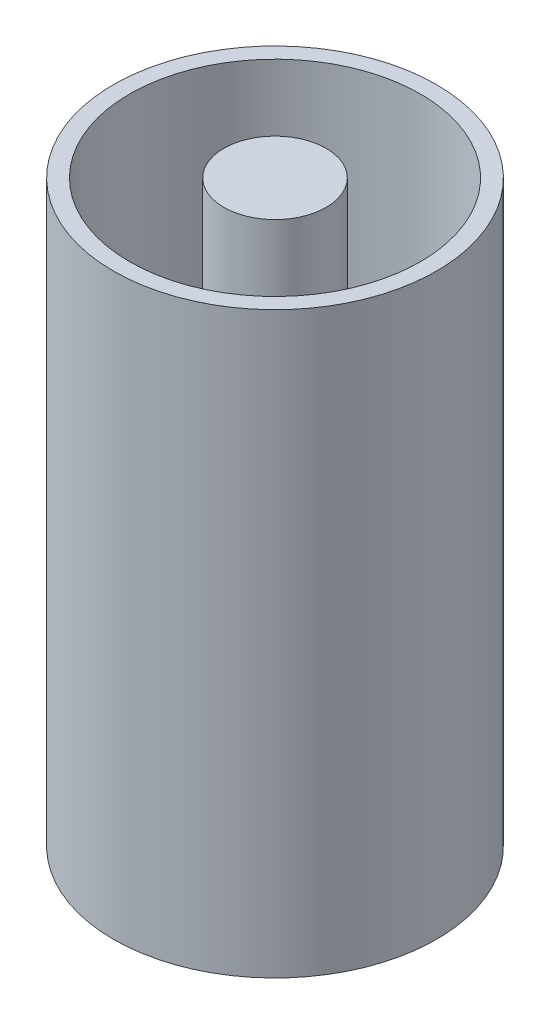
from build123d import *

# Parameters (mm, degrees)
SKETCH1_R                            = 20
BOSS_EXTRUDE1_DEPTH                  = 10
SKETCH1_R_2                          = 40
SKETCH1_R_3                          = 36
BOSS_EXTRUDE1_2_DEPTH                = 10
BOSS_EXTRUDE2_REACH                  = 89.446
BOSS_EXTRUDE2_END_RADIUS             = 36
BOSS_EXTRUDE2_START                  = 30
BOSS_EXTRUDE2_DIRECTION_2_REACH      = 89.446
BOSS_EXTRUDE2_DIRECTION_2_END_RADIUS = 20
CIRPATTERN1_COUNT                    = 12
SKETCH5_R                            = 1.735695499
BOSS_EXTRUDE3_DEPTH                  = 5
SCALE1_SCALE                         = 0.75
SKETCH6_R                            = 30
SKETCH6_R_2                          = 27
BOSS_EXTRUDE4_DEPTH                  = 100
SKETCH7_R                            = 9.5
BOSS_EXTRUDE5_DEPTH                  = 100


with BuildPart() as part:
    # Sketch1 → Boss-Extrude1 (new body)
    with BuildSketch(Plane(origin=(0, 0, 0), x_dir=(1, 0, 0), z_dir=(0, 1, 0))):
        with Locations(Location((0, 0, 0), (0, 0, 270))):
            Circle(SKETCH1_R)
    extrude(amount=BOSS_EXTRUDE1_DEPTH)


with BuildPart() as body_2:
    # Sketch1 → Boss-Extrude1 2 (new body)
    with BuildSketch(Plane(origin=(0, 0, 0), x_dir=(1, 0, 0), z_dir=(0, 1, 0))):
        with Locations(Location((0, 0, 0), (0, 0, 270))):
            Circle(SKETCH1_R_2)
        with Locations(Location((0, 0, 0), (0, 0, 270))):
            Circle(SKETCH1_R_3, mode=Mode.SUBTRACT)
    extrude(amount=BOSS_EXTRUDE1_2_DEPTH)


    add(part.part)  # Boss-Extrude2 merges part
    # Boss-Extrude2: up to this cylinder (the profile starts inside it)
    boss_extrude2_end = Plane(origin=(0, 5, 0), z_dir=(0, -1, 0)) * Cylinder(BOSS_EXTRUDE2_END_RADIUS, 251.892, mode=Mode.PRIVATE)
    # Sketch4 → Boss-Extrude2 (add, up to the surface)
    with BuildSketch(Plane(origin=(0, 0, 0), x_dir=(0, 0, -1), z_dir=(1, 0, 0)).offset(BOSS_EXTRUDE2_START), mode=Mode.PRIVATE) as boss_extrude2_sk1:
        Polygon((2.097443169, 0), (4.031443844, 10), (5.315133993, 10), (3.381133319, 0), align=None)
    boss_extrude2_tool1 = extrude(boss_extrude2_sk1.sketch, amount=BOSS_EXTRUDE2_REACH, mode=Mode.PRIVATE) & boss_extrude2_end
    boss_extrude2 = boss_extrude2_tool1.solids().sort_by_distance((30, 5, -3.706289))[0]
    add(boss_extrude2)

    # Boss-Extrude2 direction 2: up to this cylinder (the profile starts outside it)
    boss_extrude2_direction_2_end = Plane(origin=(0, 5, 0), z_dir=(0, -1, 0)) * Cylinder(BOSS_EXTRUDE2_DIRECTION_2_END_RADIUS, 219.892, mode=Mode.PRIVATE)
    # Sketch4 → Boss-Extrude2 direction 2 (add, up to the surface)
    with BuildSketch(Plane(origin=(0, 0, 0), x_dir=(0, 0, -1), z_dir=(1, 0, 0)).offset(BOSS_EXTRUDE2_START), mode=Mode.PRIVATE) as boss_extrude2_direction_2_sk1:
        Polygon((2.097443169, 0), (4.031443844, 10), (5.315133993, 10), (3.381133319, 0), align=None)
    boss_extrude2_direction_2_tool1 = extrude(boss_extrude2_direction_2_sk1.sketch, amount=-BOSS_EXTRUDE2_DIRECTION_2_REACH, mode=Mode.PRIVATE) - boss_extrude2_direction_2_end
    boss_extrude2_direction_2 = boss_extrude2_direction_2_tool1.solids().sort_by_distance((30, 5, -3.706289))[0]
    add(boss_extrude2_direction_2)
    boss_extrude2 = boss_extrude2 + boss_extrude2_direction_2  # both directions under the feature's name, for the pattern or mirror that repeats it

    # CirPattern1: Boss-Extrude2 ×12 about axis
    cirpattern1_axis = Axis((0, 0, 0), (0, 1, 0))
    for i in range(1, CIRPATTERN1_COUNT):
        add(boss_extrude2.rotate(cirpattern1_axis, i * 360 / CIRPATTERN1_COUNT))

    # Sketch5 → Boss-Extrude3 (add)
    with BuildSketch(Plane(origin=(0, 10, 0), x_dir=(1, 0, 0), z_dir=(0, 1, 0))):
        with Locations(Location((-14.887021655, 0, 0), (0, 0, 270))):
            Circle(SKETCH5_R)
        with Locations(Location((-7.443510827, 12.89253894, 0), (0, 0, 270))):
            Circle(SKETCH5_R)
        with Locations(Location((7.443510827, 12.89253894, 0), (0, 0, 270))):
            Circle(SKETCH5_R)
        with Locations(Location((14.887021655, 0, 0), (0, 0, 270))):
            Circle(SKETCH5_R)
        with Locations(Location((7.443510827, -12.89253894, 0), (0, 0, 270))):
            Circle(SKETCH5_R)
        with Locations(Location((-7.443510827, -12.89253894, 0), (0, 0, 270))):
            Circle(SKETCH5_R)
    extrude(amount=BOSS_EXTRUDE3_DEPTH)


with BuildPart() as body_2_1:
    # Scale1: scaled about (0, 0, 0)
    add(body_2.part.scale(SCALE1_SCALE))

    # Sketch6 → Boss-Extrude4 (add)
    with BuildSketch(Plane(origin=(0, 7.5, 0), x_dir=(1, 0, 0), z_dir=(0, 1, 0))):
        with Locations(Location((0, 0, 0), (0, 0, 270))):
            Circle(SKETCH6_R)
        with Locations(Location((0, 0, 0), (0, 0, 93.340075949))):
            Circle(SKETCH6_R_2, mode=Mode.SUBTRACT)
    extrude(amount=BOSS_EXTRUDE4_DEPTH)

    # Sketch7 → Boss-Extrude5 (add)
    with BuildSketch(Plane(origin=(0, 7.5, 0), x_dir=(1, 0, 0), z_dir=(0, 1, 0))):
        with Locations(Location((0, 0, 0), (0, 0, 270))):
            Circle(SKETCH7_R)
    extrude(amount=BOSS_EXTRUDE5_DEPTH)


solid = body_2_1.part
